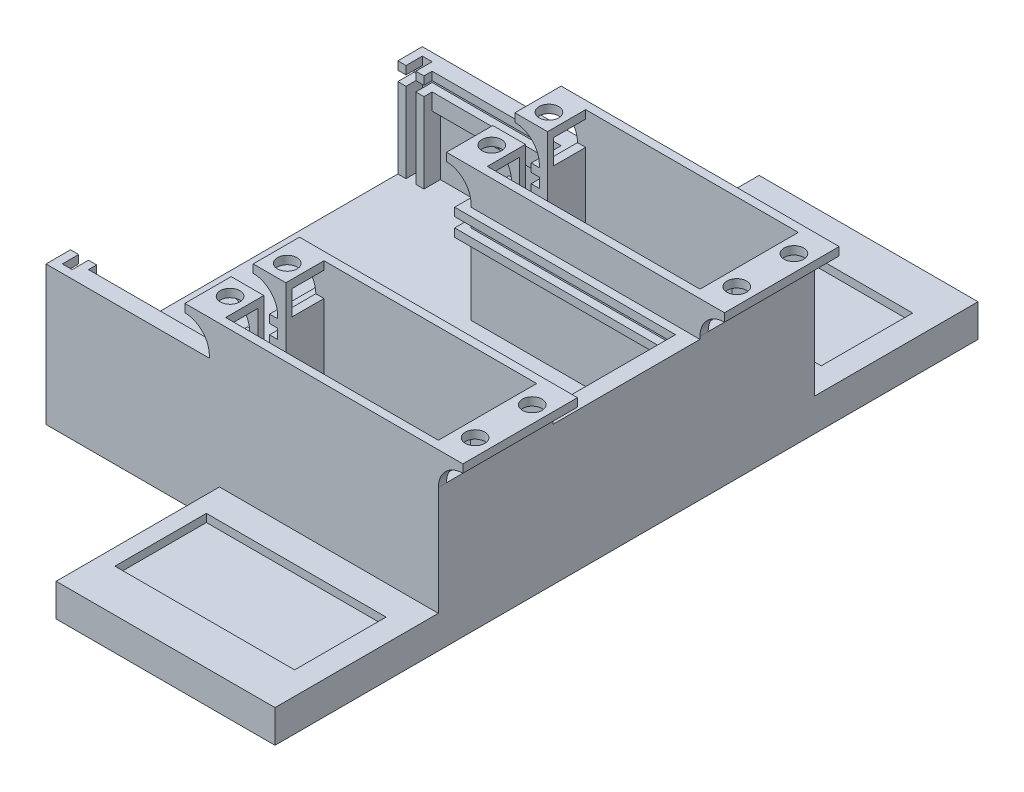
from build123d import *

# Parameters (mm, degrees)
ESQUISSE1_W                         = 120.1
ESQUISSE1_H                         = 115.2
BOSS_EXTRU_1_DEPTH                  = 12.57
ESQUISSE2_W                         = 70.1
ESQUISSE2_H                         = 35.1
BOSS_EXTRU_2_DEPTH                  = 0.01
ESQUISSE3_W                         = 70.1
ESQUISSE3_H                         = 35.1
ESQUISSE3_W_2                       = 65.1
ESQUISSE3_H_2                       = 30.1
BOSS_EXTRU_3_DEPTH                  = 40.8
ESQUISSE4_W                         = 70.1
ESQUISSE4_H                         = 35.1
ESQUISSE4_W_2                       = 65.1
ESQUISSE4_H_2                       = 30.1
BOSS_EXTRU_4_DEPTH                  = 40.8
ESQUISSE5_W                         = 67
ESQUISSE5_H                         = 10
BOSS_EXTRU_5_DEPTH                  = 50
ESQUISSE6_W                         = 55
ESQUISSE6_H                         = 28
ENL_V_MAT_EXTRU_1_DEPTH             = 5
BOSS_EXTRU_6_DEPTH                  = 35.1
ESQUISSE10_R                        = 3
ENL_V_MAT_EXTRU_2_DEPTH             = 2.5
BOSS_EXTRU_7_DEPTH                  = 35.1
ESQUISSE12_R                        = 3
ENL_V_MAT_EXTRU_3_DEPTH             = 2.5
ENL_V_MAT_EXTRU_6_REACH             = 192.164
ESQUISSE13_W                        = 9.87
ESQUISSE13_H                        = 7.5
ENL_V_MAT_EXTRU_6_DIRECTION_2_REACH = 192.164
ENL_V_MAT_EXTRU_7_REACH             = 192.164
ESQUISSE14_W                        = 9.87
ESQUISSE14_H                        = 7.5
ENL_V_MAT_EXTRU_7_DIRECTION_2_REACH = 192.164
ENL_V_MAT_EXTRU_8_REACH             = 192.164
ESQUISSE15_W                        = 6.75
ESQUISSE15_H                        = 40.8
ENL_V_MAT_EXTRU_8_DIRECTION_2_REACH = 192.164
ENL_V_MAT_EXTRU_9_REACH             = 192.164
ESQUISSE16_W                        = 6.75
ESQUISSE16_H                        = 40.8
ENL_V_MAT_EXTRU_9_DIRECTION_2_REACH = 192.164
ESQUISSE17_W                        = 2.5
ESQUISSE17_H                        = 22.5
BOSS_EXTRU_8_DEPTH                  = 30
ESQUISSE18_W                        = 50
ESQUISSE18_H                        = 2.5
BOSS_EXTRU_9_DEPTH                  = 30
ESQUISSE19_W                        = 22.5
ESQUISSE19_H                        = 2.5
BOSS_EXTRU_10_DEPTH                 = 2.5
ESQUISSE21_W                        = 65.1
ESQUISSE21_H                        = 2.5
BOSS_EXTRU_11_DEPTH                 = 2.5
ESQUISSE22_W                        = 16.675
ESQUISSE22_H                        = 2.5
ESQUISSE22_W_2                      = 11.675
BOSS_EXTRU_13_DEPTH                 = 2.5
ESQUISSE25_W                        = 42
ESQUISSE25_H                        = 2.5
ESQUISSE25_W_2                      = 2.5
ESQUISSE25_H_2                      = 27.07
BOSS_EXTRU_15_DEPTH                 = 2.5
ESQUISSE27_W                        = 2.5
ESQUISSE27_H                        = 2.5
ESQUISSE27_H_2                      = 24.5
BOSS_EXTRU_16_DEPTH                 = 2.5


with BuildPart() as part:
    # Esquisse1 → Boss.-Extru.1 (new body)
    with BuildSketch(Plane(origin=(0, 0, 0), x_dir=(1, 0, 0), z_dir=(0, 1, 0))):
        with Locations((60.05, -57.6)):
            Rectangle(ESQUISSE1_W, ESQUISSE1_H)
    extrude(amount=BOSS_EXTRU_1_DEPTH)

    # Esquisse2 → Boss.-Extru.2 (add)
    with BuildSketch(Plane(origin=(0, 12.57, 0), x_dir=(1, 0, 0), z_dir=(0, 1, 0))):
        with Locations((85.05, -17.55)):
            Rectangle(ESQUISSE2_W, ESQUISSE2_H)
    extrude(amount=BOSS_EXTRU_2_DEPTH)

    # Esquisse3 → Boss.-Extru.3 (add)
    with BuildSketch(Plane(origin=(0, 12.58, 0), x_dir=(1, 0, 0), z_dir=(0, 1, 0))):
        with Locations((85.05, -17.55)):
            Rectangle(ESQUISSE3_W, ESQUISSE3_H)
        with Locations((85.05, -17.55)):
            Rectangle(ESQUISSE3_W_2, ESQUISSE3_H_2, mode=Mode.SUBTRACT)
    extrude(amount=BOSS_EXTRU_3_DEPTH)

    # Esquisse4 → Boss.-Extru.4 (add)
    with BuildSketch(Plane(origin=(0, 12.57, 0), x_dir=(1, 0, 0), z_dir=(0, 1, 0))):
        with Locations((85.05, -97.65)):
            Rectangle(ESQUISSE4_W, ESQUISSE4_H)
        with Locations((85.05, -97.65)):
            Rectangle(ESQUISSE4_W_2, ESQUISSE4_H_2, mode=Mode.SUBTRACT)
    extrude(amount=BOSS_EXTRU_4_DEPTH)

    # Esquisse5 → Boss.-Extru.5 (add)
    with BuildSketch(Plane.XY.offset(115.2)):
        with Locations((86.6, 5)):
            Rectangle(ESQUISSE5_W, ESQUISSE5_H)
    boss_extru_5 = extrude(amount=BOSS_EXTRU_5_DEPTH)

    # Esquisse6 → Enlèv. mat.-Extru.1 (cut)
    with BuildSketch(Plane(origin=(0, 12.57, 0), x_dir=(1, 0, 0), z_dir=(0, 1, 0))):
        with Locations((85.6, -138.2)):
            Rectangle(ESQUISSE6_W, ESQUISSE6_H)
    enl_v_mat_extru_1 = extrude(amount=-ENL_V_MAT_EXTRU_1_DEPTH, mode=Mode.SUBTRACT)

    # Symétrie1: Boss.-Extru.5, Enlèv. mat.-Extru.1 across plane
    add(boss_extru_5.mirror(Plane(origin=(0, 0, 57.6), x_dir=(1, 0, 0), z_dir=(0, 0, -1))))
    add(enl_v_mat_extru_1.mirror(Plane(origin=(0, 0, 57.6), x_dir=(1, 0, 0), z_dir=(0, 0, -1))), mode=Mode.SUBTRACT)

    # Esquisse8 → Boss.-Extru.6 (add)
    with BuildSketch(Plane(origin=(0, 0, 0), x_dir=(-1, 0, 0), z_dir=(0, 0, -1))):
        with BuildLine():
            Line((-50, 53.38), (-42.5, 53.38))
            Line((-42.5, 53.38), (-42.5, 50.88))
            ThreePointArc((-42.5, 50.88), (-47.803300859, 48.683300859), (-50, 43.38))
            Line((-50, 43.38), (-50, 53.38))
        make_face()
    boss_extru_6 = extrude(amount=-BOSS_EXTRU_6_DEPTH)

    # Esquisse10 → Enlèv. mat.-Extru.2 (cut)
    with BuildSketch(Plane(origin=(0, 53.38, 0), x_dir=(1, 0, 0), z_dir=(0, 1, 0))):
        with Locations(Location((47.55, -8.8, 0), (0, 0, 270))):
            Circle(ESQUISSE10_R)
        with Locations(Location((47.55, -26.3, 0), (0, 0, 270))):
            Circle(ESQUISSE10_R)
    enl_v_mat_extru_2 = extrude(amount=-ENL_V_MAT_EXTRU_2_DEPTH, mode=Mode.SUBTRACT)

    # Symétrie2: Boss.-Extru.6, Enlèv. mat.-Extru.2 across plane
    add(boss_extru_6.mirror(Plane.ZY.offset(-85.05)))
    add(enl_v_mat_extru_2.mirror(Plane.ZY.offset(-85.05)), mode=Mode.SUBTRACT)

    # Esquisse11 → Boss.-Extru.7 (add)
    with BuildSketch(Plane.XY.offset(115.2)):
        with BuildLine():
            Line((50, 43.37), (50, 53.37))
            Line((50, 53.37), (42.5, 53.37))
            Line((42.5, 53.37), (42.5, 50.87))
            ThreePointArc((42.5, 50.87), (47.803300859, 48.673300859), (50, 43.37))
        make_face()
    boss_extru_7 = extrude(amount=-BOSS_EXTRU_7_DEPTH)

    # Esquisse12 → Enlèv. mat.-Extru.3 (cut)
    with BuildSketch(Plane(origin=(0, 53.37, 0), x_dir=(1, 0, 0), z_dir=(0, 1, 0))):
        with Locations(Location((47.55, -88.9, 0), (0, 0, 270))):
            Circle(ESQUISSE12_R)
        with Locations(Location((47.55, -106.4, 0), (0, 0, 270))):
            Circle(ESQUISSE12_R)
    enl_v_mat_extru_3 = extrude(amount=-ENL_V_MAT_EXTRU_3_DEPTH, mode=Mode.SUBTRACT)

    # Esquisse13 → Enlèv. mat.-Extru.6 (cut, up to next)
    with BuildSketch(Plane.ZY.offset(-50), mode=Mode.PRIVATE) as enl_v_mat_extru_6_sk1:
        with Locations((87.535, 47.12)):
            Rectangle(ESQUISSE13_W, ESQUISSE13_H)
    enl_v_mat_extru_6_tool1 = extrude(enl_v_mat_extru_6_sk1.sketch, amount=-ENL_V_MAT_EXTRU_6_REACH, mode=Mode.PRIVATE) & part.part
    # Esquisse13 → Enlèv. mat.-Extru.6 (cut, up to next)
    with BuildSketch(Plane.ZY.offset(-50), mode=Mode.PRIVATE) as enl_v_mat_extru_6_sk2:
        with Locations((107.765, 47.12)):
            Rectangle(ESQUISSE13_W, ESQUISSE13_H)
    enl_v_mat_extru_6_tool2 = extrude(enl_v_mat_extru_6_sk2.sketch, amount=-ENL_V_MAT_EXTRU_6_REACH, mode=Mode.PRIVATE) & part.part
    enl_v_mat_extru_6_1 = enl_v_mat_extru_6_tool1.solids().sort_by_distance((50, 47.12, 87.535))[0]
    add(enl_v_mat_extru_6_1, mode=Mode.SUBTRACT)
    enl_v_mat_extru_6_2 = enl_v_mat_extru_6_tool2.solids().sort_by_distance((50, 47.12, 107.765))[0]
    add(enl_v_mat_extru_6_2, mode=Mode.SUBTRACT)
    enl_v_mat_extru_6 = enl_v_mat_extru_6_1 + enl_v_mat_extru_6_2  # Enlèv. mat.-Extru.6 as one shape, for the pattern or mirror that repeats it

    # Esquisse13 → Enlèv. mat.-Extru.6 direction 2 (cut, up to next)
    with BuildSketch(Plane.ZY.offset(-50), mode=Mode.PRIVATE) as enl_v_mat_extru_6_direction_2_sk1:
        with Locations((87.535, 47.12)):
            Rectangle(ESQUISSE13_W, ESQUISSE13_H)
    enl_v_mat_extru_6_direction_2_tool1 = extrude(enl_v_mat_extru_6_direction_2_sk1.sketch, amount=ENL_V_MAT_EXTRU_6_DIRECTION_2_REACH, mode=Mode.PRIVATE) & part.part
    # Esquisse13 → Enlèv. mat.-Extru.6 direction 2 (cut, up to next)
    with BuildSketch(Plane.ZY.offset(-50), mode=Mode.PRIVATE) as enl_v_mat_extru_6_direction_2_sk2:
        with Locations((107.765, 47.12)):
            Rectangle(ESQUISSE13_W, ESQUISSE13_H)
    enl_v_mat_extru_6_direction_2_tool2 = extrude(enl_v_mat_extru_6_direction_2_sk2.sketch, amount=ENL_V_MAT_EXTRU_6_DIRECTION_2_REACH, mode=Mode.PRIVATE) & part.part
    enl_v_mat_extru_6_direction_2_1 = enl_v_mat_extru_6_direction_2_tool1.solids().sort_by_distance((50, 47.12, 87.535))[0]
    add(enl_v_mat_extru_6_direction_2_1, mode=Mode.SUBTRACT)
    enl_v_mat_extru_6_direction_2_2 = enl_v_mat_extru_6_direction_2_tool2.solids().sort_by_distance((50, 47.12, 107.765))[0]
    add(enl_v_mat_extru_6_direction_2_2, mode=Mode.SUBTRACT)
    enl_v_mat_extru_6_direction_2 = enl_v_mat_extru_6_direction_2_1 + enl_v_mat_extru_6_direction_2_2  # Enlèv. mat.-Extru.6 direction 2 as one shape, for the pattern or mirror that repeats it

    # Esquisse14 → Enlèv. mat.-Extru.7 (cut, up to next)
    with BuildSketch(Plane.ZY.offset(-50), mode=Mode.PRIVATE) as enl_v_mat_extru_7_sk1:
        with Locations((7.435, 47.13)):
            Rectangle(ESQUISSE14_W, ESQUISSE14_H)
    enl_v_mat_extru_7_tool1 = extrude(enl_v_mat_extru_7_sk1.sketch, amount=-ENL_V_MAT_EXTRU_7_REACH, mode=Mode.PRIVATE) & part.part
    # Esquisse14 → Enlèv. mat.-Extru.7 (cut, up to next)
    with BuildSketch(Plane.ZY.offset(-50), mode=Mode.PRIVATE) as enl_v_mat_extru_7_sk2:
        with Locations((27.665, 47.13)):
            Rectangle(ESQUISSE14_W, ESQUISSE14_H)
    enl_v_mat_extru_7_tool2 = extrude(enl_v_mat_extru_7_sk2.sketch, amount=-ENL_V_MAT_EXTRU_7_REACH, mode=Mode.PRIVATE) & part.part
    enl_v_mat_extru_7_1 = enl_v_mat_extru_7_tool1.solids().sort_by_distance((50, 47.13, 7.435))[0]
    add(enl_v_mat_extru_7_1, mode=Mode.SUBTRACT)
    enl_v_mat_extru_7_2 = enl_v_mat_extru_7_tool2.solids().sort_by_distance((50, 47.13, 27.665))[0]
    add(enl_v_mat_extru_7_2, mode=Mode.SUBTRACT)
    enl_v_mat_extru_7 = enl_v_mat_extru_7_1 + enl_v_mat_extru_7_2  # Enlèv. mat.-Extru.7 as one shape, for the pattern or mirror that repeats it

    # Esquisse14 → Enlèv. mat.-Extru.7 direction 2 (cut, up to next)
    with BuildSketch(Plane.ZY.offset(-50), mode=Mode.PRIVATE) as enl_v_mat_extru_7_direction_2_sk1:
        with Locations((7.435, 47.13)):
            Rectangle(ESQUISSE14_W, ESQUISSE14_H)
    enl_v_mat_extru_7_direction_2_tool1 = extrude(enl_v_mat_extru_7_direction_2_sk1.sketch, amount=ENL_V_MAT_EXTRU_7_DIRECTION_2_REACH, mode=Mode.PRIVATE) & part.part
    # Esquisse14 → Enlèv. mat.-Extru.7 direction 2 (cut, up to next)
    with BuildSketch(Plane.ZY.offset(-50), mode=Mode.PRIVATE) as enl_v_mat_extru_7_direction_2_sk2:
        with Locations((27.665, 47.13)):
            Rectangle(ESQUISSE14_W, ESQUISSE14_H)
    enl_v_mat_extru_7_direction_2_tool2 = extrude(enl_v_mat_extru_7_direction_2_sk2.sketch, amount=ENL_V_MAT_EXTRU_7_DIRECTION_2_REACH, mode=Mode.PRIVATE) & part.part
    enl_v_mat_extru_7_direction_2_1 = enl_v_mat_extru_7_direction_2_tool1.solids().sort_by_distance((50, 47.13, 7.435))[0]
    add(enl_v_mat_extru_7_direction_2_1, mode=Mode.SUBTRACT)
    enl_v_mat_extru_7_direction_2_2 = enl_v_mat_extru_7_direction_2_tool2.solids().sort_by_distance((50, 47.13, 27.665))[0]
    add(enl_v_mat_extru_7_direction_2_2, mode=Mode.SUBTRACT)
    enl_v_mat_extru_7_direction_2 = enl_v_mat_extru_7_direction_2_1 + enl_v_mat_extru_7_direction_2_2  # Enlèv. mat.-Extru.7 direction 2 as one shape, for the pattern or mirror that repeats it

    # Esquisse15 → Enlèv. mat.-Extru.8 (cut, up to next)
    with BuildSketch(Plane.ZY.offset(-50), mode=Mode.PRIVATE) as enl_v_mat_extru_8_sk1:
        with Locations((17.55, 32.98)):
            Rectangle(ESQUISSE15_W, ESQUISSE15_H)
    enl_v_mat_extru_8_tool1 = extrude(enl_v_mat_extru_8_sk1.sketch, amount=-ENL_V_MAT_EXTRU_8_REACH, mode=Mode.PRIVATE) & part.part
    add(enl_v_mat_extru_8_tool1.solids().sort_by_distance((50, 32.98, 17.55))[0], mode=Mode.SUBTRACT)

    # Esquisse15 → Enlèv. mat.-Extru.8 direction 2 (cut, up to next)
    with BuildSketch(Plane.ZY.offset(-50), mode=Mode.PRIVATE) as enl_v_mat_extru_8_direction_2_sk1:
        with Locations((17.55, 32.98)):
            Rectangle(ESQUISSE15_W, ESQUISSE15_H)
    enl_v_mat_extru_8_direction_2_tool1 = extrude(enl_v_mat_extru_8_direction_2_sk1.sketch, amount=ENL_V_MAT_EXTRU_8_DIRECTION_2_REACH, mode=Mode.PRIVATE) & part.part
    add(enl_v_mat_extru_8_direction_2_tool1.solids().sort_by_distance((50, 32.98, 17.55))[0], mode=Mode.SUBTRACT)

    # Esquisse16 → Enlèv. mat.-Extru.9 (cut, up to next)
    with BuildSketch(Plane.ZY.offset(-50), mode=Mode.PRIVATE) as enl_v_mat_extru_9_sk1:
        with Locations((97.65, 32.97)):
            Rectangle(ESQUISSE16_W, ESQUISSE16_H)
    enl_v_mat_extru_9_tool1 = extrude(enl_v_mat_extru_9_sk1.sketch, amount=-ENL_V_MAT_EXTRU_9_REACH, mode=Mode.PRIVATE) & part.part
    add(enl_v_mat_extru_9_tool1.solids().sort_by_distance((50, 32.97, 97.65))[0], mode=Mode.SUBTRACT)

    # Esquisse16 → Enlèv. mat.-Extru.9 direction 2 (cut, up to next)
    with BuildSketch(Plane.ZY.offset(-50), mode=Mode.PRIVATE) as enl_v_mat_extru_9_direction_2_sk1:
        with Locations((97.65, 32.97)):
            Rectangle(ESQUISSE16_W, ESQUISSE16_H)
    enl_v_mat_extru_9_direction_2_tool1 = extrude(enl_v_mat_extru_9_direction_2_sk1.sketch, amount=ENL_V_MAT_EXTRU_9_DIRECTION_2_REACH, mode=Mode.PRIVATE) & part.part
    add(enl_v_mat_extru_9_direction_2_tool1.solids().sort_by_distance((50, 32.97, 97.65))[0], mode=Mode.SUBTRACT)

    # Symétrie3: Boss.-Extru.7, Enlèv. mat.-Extru.3, Enlèv. mat.-Extru.6, Enlèv. mat.-Extru.6 direction 2, Enlèv. mat.-Extru.7, Enlèv. mat.-Extru.7 direction 2 across plane
    add(boss_extru_7.mirror(Plane.ZY.offset(-85.05)))
    add(enl_v_mat_extru_3.mirror(Plane.ZY.offset(-85.05)), mode=Mode.SUBTRACT)
    add(enl_v_mat_extru_6.mirror(Plane.ZY.offset(-85.05)), mode=Mode.SUBTRACT)
    add(enl_v_mat_extru_6_direction_2.mirror(Plane.ZY.offset(-85.05)), mode=Mode.SUBTRACT)
    add(enl_v_mat_extru_7.mirror(Plane.ZY.offset(-85.05)), mode=Mode.SUBTRACT)
    add(enl_v_mat_extru_7_direction_2.mirror(Plane.ZY.offset(-85.05)), mode=Mode.SUBTRACT)

    # Esquisse17 → Boss.-Extru.8 (add)
    with BuildSketch(Plane(origin=(0, 12.57, 0), x_dir=(1, 0, 0), z_dir=(0, 1, 0))):
        with Locations((118.85, -46.35)):
            Rectangle(ESQUISSE17_W, ESQUISSE17_H)
    boss_extru_8 = extrude(amount=BOSS_EXTRU_8_DEPTH)

    # Esquisse18 → Boss.-Extru.9 (add)
    with BuildSketch(Plane(origin=(0, 12.57, 0), x_dir=(1, 0, 0), z_dir=(0, 1, 0))):
        with Locations((25, -1.25)):
            Rectangle(ESQUISSE18_W, ESQUISSE18_H)
    boss_extru_9 = extrude(amount=BOSS_EXTRU_9_DEPTH)

    # Esquisse19 → Boss.-Extru.10 (add)
    with BuildSketch(Plane.ZY.offset(-117.6)):
        with Locations((46.35, 35.82)):
            Rectangle(ESQUISSE19_W, ESQUISSE19_H)
        with Locations((46.35, 41.32)):
            Rectangle(ESQUISSE19_W, ESQUISSE19_H)
    boss_extru_10 = extrude(amount=BOSS_EXTRU_10_DEPTH)

    # Esquisse21 → Boss.-Extru.11 (add)
    with BuildSketch(Plane.XY.offset(35.1)):
        with Locations((82.55, 41.32)):
            Rectangle(ESQUISSE21_W, ESQUISSE21_H)
        with Locations((82.55, 35.82)):
            Rectangle(ESQUISSE21_W, ESQUISSE21_H)
    boss_extru_11 = extrude(amount=BOSS_EXTRU_11_DEPTH)

    # Esquisse22 → Boss.-Extru.13 (add)
    with BuildSketch(Plane.ZY.offset(-50)):
        with Locations((29.2625, 41.32)):
            Rectangle(ESQUISSE22_W, ESQUISSE22_H)
        with Locations((29.2625, 35.82)):
            Rectangle(ESQUISSE22_W, ESQUISSE22_H)
        with Locations((8.3375, 35.82)):
            Rectangle(ESQUISSE22_W_2, ESQUISSE22_H)
        with Locations((8.3375, 41.32)):
            Rectangle(ESQUISSE22_W_2, ESQUISSE22_H)
    boss_extru_13 = extrude(amount=BOSS_EXTRU_13_DEPTH)

    # Esquisse25 → Boss.-Extru.15 (add)
    with BuildSketch(Plane.XY.offset(2.5)):
        with Locations((26.5, 41.32)):
            Rectangle(ESQUISSE25_W, ESQUISSE25_H)
        Polygon((47.5, 37.07), (5.5, 37.07), (5.5, 32), (5.5, 12.57), (8, 12.57), (8, 32), (47.5, 32), align=None)
        with Locations((1.25, 41.32)):
            Rectangle(ESQUISSE25_W_2, ESQUISSE25_H)
        with Locations((1.25, 23.535)):
            Rectangle(ESQUISSE25_W_2, ESQUISSE25_H_2)
    boss_extru_15 = extrude(amount=BOSS_EXTRU_15_DEPTH)

    # Esquisse27 → Boss.-Extru.16 (add)
    with BuildSketch(Plane.XY.offset(5)):
        with Locations((1.25, 41.32)):
            Rectangle(ESQUISSE27_W, ESQUISSE27_H)
        with Locations((6.75, 41.32)):
            Rectangle(ESQUISSE27_W, ESQUISSE27_H)
        with Locations((6.75, 24.82)):
            Rectangle(ESQUISSE27_W, ESQUISSE27_H_2)
        with Locations((1.25, 24.82)):
            Rectangle(ESQUISSE27_W, ESQUISSE27_H_2)
    boss_extru_16 = extrude(amount=BOSS_EXTRU_16_DEPTH)

    # Symétrie5: Boss.-Extru.8, Boss.-Extru.9, Boss.-Extru.10, Boss.-Extru.11, Boss.-Extru.13, Boss.-Extru.15, Boss.-Extru.16 across plane
    add(boss_extru_8.mirror(Plane(origin=(0, 0, 57.6), x_dir=(1, 0, 0), z_dir=(0, 0, -1))))
    add(boss_extru_9.mirror(Plane(origin=(0, 0, 57.6), x_dir=(1, 0, 0), z_dir=(0, 0, -1))))
    add(boss_extru_10.mirror(Plane(origin=(0, 0, 57.6), x_dir=(1, 0, 0), z_dir=(0, 0, -1))))
    add(boss_extru_11.mirror(Plane(origin=(0, 0, 57.6), x_dir=(1, 0, 0), z_dir=(0, 0, -1))))
    add(boss_extru_13.mirror(Plane(origin=(0, 0, 57.6), x_dir=(1, 0, 0), z_dir=(0, 0, -1))))
    add(boss_extru_15.mirror(Plane(origin=(0, 0, 57.6), x_dir=(1, 0, 0), z_dir=(0, 0, -1))))
    add(boss_extru_16.mirror(Plane(origin=(0, 0, 57.6), x_dir=(1, 0, 0), z_dir=(0, 0, -1))))


solid = part.part
